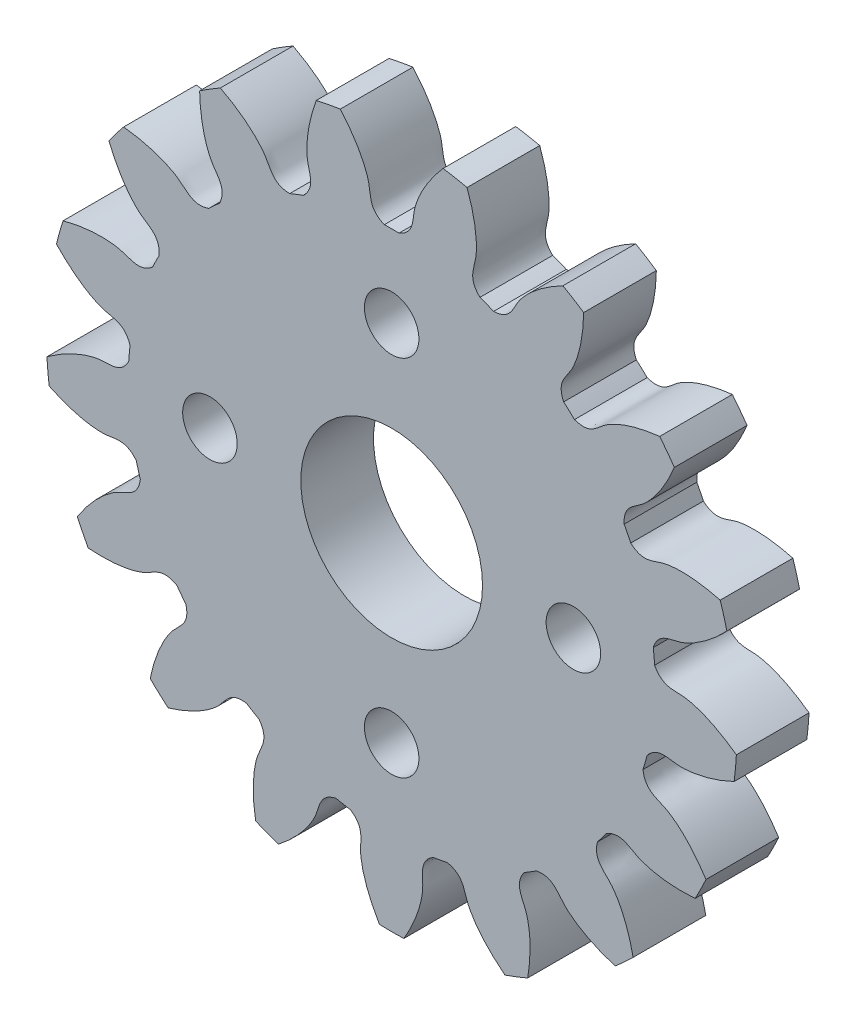
from build123d import *

# Parameters (mm, degrees)
SKETCH_1_R               = 19
EXTRUDE_1_DEPTH          = 4
CUT_EXTRUDE_1_DEPTH      = 28.166155414
PATTERN_CIRCULAR_1_COUNT = 17
SKETCH_4_R               = 5
CUT_EXTRUDE_2_DEPTH      = 10
SKETCH_5_R               = 1.5
CUT_EXTRUDE_3_DEPTH      = 10


with BuildPart() as part:
    # 草图1 → 凸台-拉伸1 (new body)
    with BuildSketch(Plane.XY):
        Circle(SKETCH_1_R)
    extrude(amount=EXTRUDE_1_DEPTH)

    # 草图2 → 切除-拉伸1 (cut, through all)
    with BuildSketch(Plane.XY):
        with BuildLine():
            ThreePointArc((0.403387494, 14.494387829), (0, 14.5), (-0.403387494, 14.494387829))
            add(Edge.make_bspline(
                [(-0.403387494, 14.494387829), (-1.255759481, 14.849644042), (-1.132390756, 15.509626813), (-1.276611209, 16.129648275), (-1.289951469, 16.18230119), (-1.306037005, 16.240838627), (-1.32510118, 16.305170665), (-1.347383555, 16.375198727), (-1.373118159, 16.450817515), (-1.40253689, 16.531914502), (-1.435868224, 16.618370188), (-1.473337358, 16.710058129), (-1.515165928, 16.80684504), (-1.561571855, 16.908590882), (-1.612769151, 17.015148962), (-1.66896775, 17.12636603), (-1.730373323, 17.242082389), (-1.797187111, 17.362132), (-1.869605751, 17.4863426), (-1.947821109, 17.61453582), (-2.032020115, 17.746527309), (-2.1223846, 17.882126855), (-2.219091138, 18.021138524), (-2.32231089, 18.163360791), (-2.432209452, 18.308586678), (-2.548946705, 18.456603899), (-2.67267667, 18.607195006), (-2.803547366, 18.760137539), (-2.941700674, 18.915204179), (-3.087272199, 19.072162909), (-3.24039114, 19.23077717), (-3.401180166, 19.390806026), (-3.569755292, 19.552004336), (-3.746225758, 19.71412292), (-3.930693918, 19.876908731), (-4.123255131, 20.040105038), (-4.323997649, 20.203451599), (-4.533002522, 20.366684847), (-4.750343497, 20.529538073), (-4.976086928, 20.691741613), (-5.210291694, 20.853023038), (-5.453009069, 21.013107349), (-5.79164327, 21.226861067), (-6.053153804, 21.381051942), (-6.231291666, 21.481438237)],
                knots=[0, 0, 0, 0, 0.193882922, 0.199023975, 0.204850501, 0.211362501, 0.218559975, 0.226442923, 0.235011345, 0.24426524, 0.254204608, 0.264829451, 0.276139767, 0.288135557, 0.300816821, 0.314183558, 0.328235769, 0.342973453, 0.358396612, 0.374505244, 0.39129935, 0.408778929, 0.426943982, 0.445794509, 0.46533051, 0.485551984, 0.506458932, 0.528051354, 0.550329249, 0.573292619, 0.596941461, 0.621275778, 0.646295568, 0.672000832, 0.69839157, 0.725467781, 0.753229466, 0.781676625, 0.810809257, 0.840627364, 0.871130943, 0.902319997, 0.934194524, 1, 1, 1, 1], degree=3))
            ThreePointArc((-6.231291666, 21.481438237), (0, 22.366966369), (6.231291666, 21.481438237))
            add(Edge.make_bspline(
                [(0.403387494, 14.494387829), (1.255759481, 14.849644042), (1.132390756, 15.509626813), (1.276611209, 16.129648275), (1.289951469, 16.18230119), (1.306037005, 16.240838627), (1.32510118, 16.305170665), (1.347383555, 16.375198727), (1.373118159, 16.450817515), (1.40253689, 16.531914502), (1.435868224, 16.618370188), (1.473337358, 16.710058129), (1.515165928, 16.80684504), (1.561571855, 16.908590882), (1.612769151, 17.015148962), (1.66896775, 17.12636603), (1.730373323, 17.242082389), (1.797187111, 17.362132), (1.869605751, 17.4863426), (1.947821109, 17.61453582), (2.032020115, 17.746527309), (2.1223846, 17.882126855), (2.219091138, 18.021138524), (2.32231089, 18.163360791), (2.432209452, 18.308586678), (2.548946705, 18.456603899), (2.67267667, 18.607195006), (2.803547366, 18.760137539), (2.941700674, 18.915204179), (3.087272199, 19.072162909), (3.24039114, 19.23077717), (3.401180166, 19.390806026), (3.569755292, 19.552004336), (3.746225758, 19.71412292), (3.930693918, 19.876908731), (4.123255131, 20.040105038), (4.323997649, 20.203451599), (4.533002522, 20.366684847), (4.750343497, 20.529538073), (4.976086928, 20.691741613), (5.210291694, 20.853023038), (5.453009069, 21.013107349), (5.79164327, 21.226861067), (6.053153804, 21.381051942), (6.231291666, 21.481438237)],
                knots=[0, 0, 0, 0, 0.193882922, 0.199023975, 0.204850501, 0.211362501, 0.218559975, 0.226442923, 0.235011345, 0.24426524, 0.254204608, 0.264829451, 0.276139767, 0.288135557, 0.300816821, 0.314183558, 0.328235769, 0.342973453, 0.358396612, 0.374505244, 0.39129935, 0.408778929, 0.426943982, 0.445794509, 0.46533051, 0.485551984, 0.506458932, 0.528051354, 0.550329249, 0.573292619, 0.596941461, 0.621275778, 0.646295568, 0.672000832, 0.69839157, 0.725467781, 0.753229466, 0.781676625, 0.810809257, 0.840627364, 0.871130943, 0.902319997, 0.934194524, 1, 1, 1, 1], degree=3))
        make_face()
    cut_extrude_1 = extrude(amount=CUT_EXTRUDE_1_DEPTH, mode=Mode.SUBTRACT)

    # 阵列(圆周)1: 切除-拉伸1 ×17 about axis
    pattern_circular_1_axis = Axis((0, 0, -0.2), (0, 0, 1))
    for i in range(1, PATTERN_CIRCULAR_1_COUNT):
        add(cut_extrude_1.rotate(pattern_circular_1_axis, i * 360 / PATTERN_CIRCULAR_1_COUNT), mode=Mode.SUBTRACT)

    # 草图4 → 切除-拉伸2 (cut)
    with BuildSketch(Plane.XY.offset(4)):
        Circle(SKETCH_4_R)
    extrude(amount=-CUT_EXTRUDE_2_DEPTH, mode=Mode.SUBTRACT)

    # 草图5 → 切除-拉伸3 (cut)
    with BuildSketch(Plane.XY.offset(4)):
        with Locations((0, 10)):
            Circle(SKETCH_5_R)
        with Locations((10, 0)):
            Circle(SKETCH_5_R)
        with Locations((0, -10)):
            Circle(SKETCH_5_R)
        with Locations((-10, 0)):
            Circle(SKETCH_5_R)
    extrude(amount=-CUT_EXTRUDE_3_DEPTH, mode=Mode.SUBTRACT)


solid = part.part
